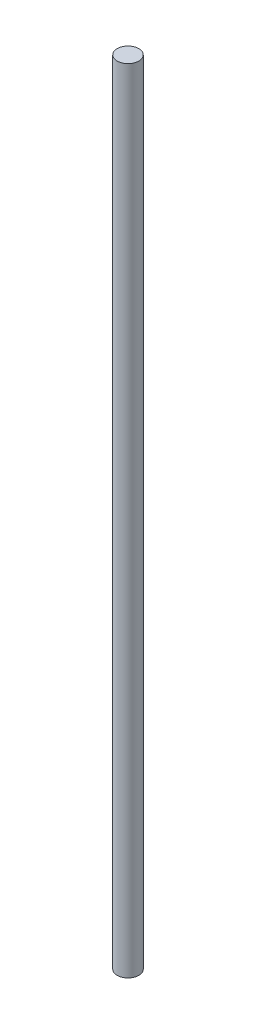
from build123d import *

# Parameters (mm, degrees)
SKETCH_1_R      = 3
EXTRUDE_1_DEPTH = 220


with BuildPart() as part:
    # 草图1 → 凸台-拉伸1 (new body)
    with BuildSketch(Plane(origin=(0, 0, 0), x_dir=(1, 0, 0), z_dir=(0, 1, 0))):
        with Locations(Location((0, 0, 0), (0, 0, 270))):
            Circle(SKETCH_1_R)
    extrude(amount=EXTRUDE_1_DEPTH)


solid = part.part
